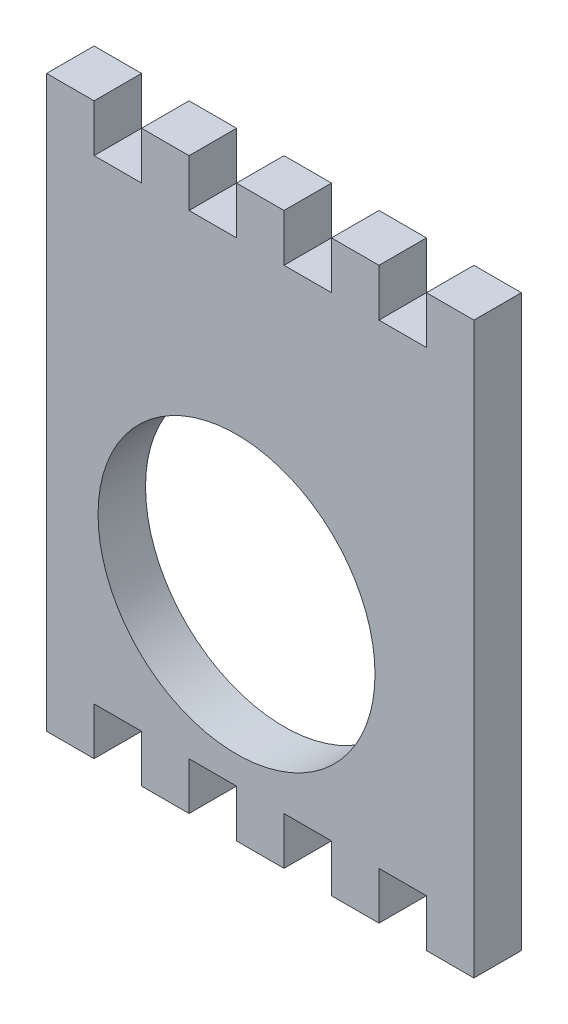
from build123d import *

# Parameters (mm, degrees)
SKETCH1_R           = 8.75
BOSS_EXTRUDE1_DEPTH = 3


with BuildPart() as part:
    # Sketch1 → Boss-Extrude1 (new body)
    with BuildSketch(Plane.XY):
        Polygon((-33.829731544, 43.380302013), (-30.829731544, 43.380302013), (-30.829731544, 40.380302013), (-27.829731544, 40.380302013), (-27.829731544, 43.380302013), (-24.829731544, 43.380302013), (-24.829731544, 40.380302013), (-21.829731544, 40.380302013), (-21.829731544, 43.380302013), (-18.829731544, 43.380302013), (-18.829731544, 40.380302013), (-15.829731544, 40.380302013), (-15.829731544, 43.380302013), (-12.829731544, 43.380302013), (-12.829731544, 40.380302013), (-9.829731544, 40.380302013), (-9.829731544, 43.380302013), (-6.829731544, 43.380302013), (-6.829731544, 7.380302013), (-9.829731544, 7.380302013), (-9.829731544, 10.380302013), (-12.829731544, 10.380302013), (-12.829731544, 7.380302013), (-15.829731544, 7.380302013), (-15.829731544, 10.380302013), (-18.829731544, 10.380302013), (-18.829731544, 7.380302013), (-21.829731544, 7.380302013), (-21.829731544, 10.380302013), (-24.829731544, 10.380302013), (-24.829731544, 7.380302013), (-27.829731544, 7.380302013), (-27.829731544, 10.380302013), (-30.829731544, 10.380302013), (-30.829731544, 7.380302013), (-33.829731544, 7.380302013), align=None)
        with Locations((-21.829731544, 20.880302013)):
            Circle(SKETCH1_R, mode=Mode.SUBTRACT)
    extrude(amount=BOSS_EXTRUDE1_DEPTH)


solid = part.part
